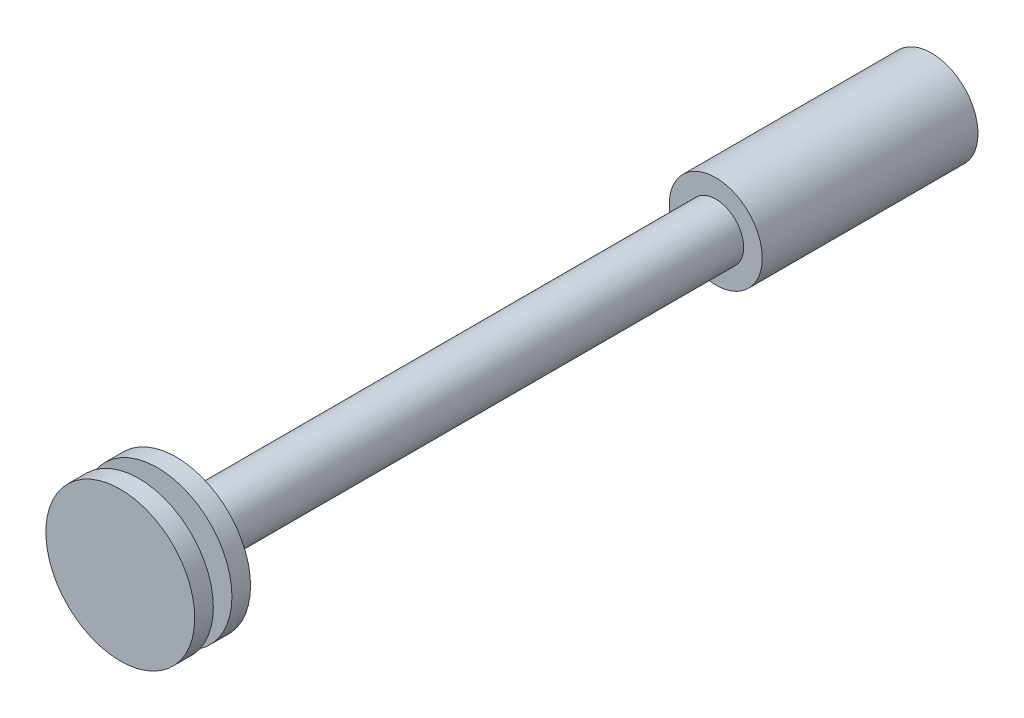
from build123d import *

# Parameters (mm, degrees)
SKETCH_1_R               = 3
EXTRUDE_1_DEPTH          = 180
SKETCH_2_R               = 8
EXTRUDE_2_DEPTH          = 2
EXTRUDE_START            = -178
SKETCH_2_2_R             = 8
EXTRUDE_3_DEPTH          = 2
EXTRUDE_START_2          = -2
SKETCH_1_2_R             = 3
EXTRUDE_4_DEPTH          = 2
EXTRUDE_START_3          = 180
SKETCH_1_3_R             = 3
EXTRUDE_5_DEPTH          = 2
EXTRUDE_START_4          = 4
SKETCH_2_3_R             = 8
EXTRUDE_6_DEPTH          = 2
EXTRUDE_START_5          = -182
SKETCH_2_4_R             = 8
EXTRUDE_7_DEPTH          = 2
EXTRUDE_START_6          = -64
SKETCH_3_R               = 5
EXTRUDE_10_DEPTH         = 60
CUT_EXTRUDE_1_DEPTH      = 185.347497949
CUT_EXTRUDE_1_DEPTH_BACK = 185.347497949
SKETCH_4_W               = 115.941163498
SKETCH_4_H               = 45.19740272


with BuildPart() as part:
    # 草图1 → 凸台-拉伸1 (new body)
    with BuildSketch(Plane.XY):
        with Locations(Location((0, 0, 0), (0, 0, 180))):
            Circle(SKETCH_1_R)
    extrude(amount=EXTRUDE_1_DEPTH)

    # 草图2 → 凸台-拉伸2 (add)
    with BuildSketch(Plane.XY.offset(180)):
        Circle(SKETCH_2_R)
    extrude(amount=-EXTRUDE_2_DEPTH)

    # 草图2<2> → 凸台-拉伸3 (add)
    with BuildSketch(Plane.XY.offset(180).offset(EXTRUDE_START)):
        Circle(SKETCH_2_2_R)
    extrude(amount=-EXTRUDE_3_DEPTH)

    # 草图1<2> → 凸台-拉伸4 (add)
    with BuildSketch(Plane.XY.offset(EXTRUDE_START_2)):
        with Locations(Location((0, 0, 0), (0, 0, 180))):
            Circle(SKETCH_1_2_R)
    extrude(amount=EXTRUDE_4_DEPTH)

    # 草图1<3> → 凸台-拉伸5 (add)
    with BuildSketch(Plane.XY.offset(EXTRUDE_START_3)):
        with Locations(Location((0, 0, 0), (0, 0, 180))):
            Circle(SKETCH_1_3_R)
    extrude(amount=EXTRUDE_5_DEPTH)

    # 草图2<3> → 凸台-拉伸6 (add)
    with BuildSketch(Plane.XY.offset(180).offset(EXTRUDE_START_4)):
        Circle(SKETCH_2_3_R)
    extrude(amount=-EXTRUDE_6_DEPTH)

    # 草图2<4> → 凸台-拉伸7 (add)
    with BuildSketch(Plane.XY.offset(180).offset(EXTRUDE_START_5)):
        Circle(SKETCH_2_4_R)
    extrude(amount=-EXTRUDE_7_DEPTH)

    # 草图3 → 凸台-拉伸10 (add)
    with BuildSketch(Plane.XY.offset(184).offset(EXTRUDE_START_6)):
        Circle(SKETCH_3_R)
    extrude(amount=-EXTRUDE_10_DEPTH)

    # 草图4 → 切除-拉伸1 (cut, two sides: drawn at the far end of the back side and taken through both)
    with BuildSketch(Plane(origin=(0, 0, 0), x_dir=(0, 0, -1), z_dir=(1, 0, 0)).offset(-CUT_EXTRUDE_1_DEPTH_BACK)):
        with Locations((-38.8417804, 0.262013929)):
            Rectangle(SKETCH_4_W, SKETCH_4_H)
    extrude(amount=CUT_EXTRUDE_1_DEPTH + CUT_EXTRUDE_1_DEPTH_BACK, mode=Mode.SUBTRACT)


solid = part.part
